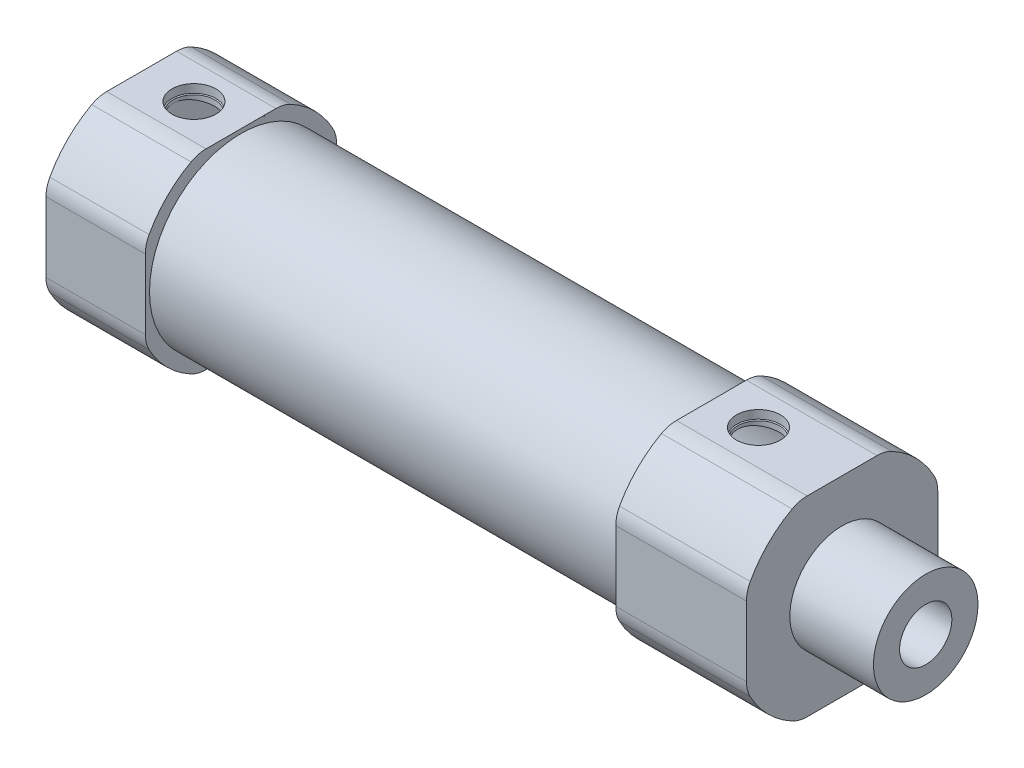
from build123d import *

# Parameters (mm, degrees)
SKETCH_473_R           = 8.75
EXTRUDE_523_DEPTH      = 67
EXTRUDE_START          = -12.5
SKETCH_1_R             = 8.75
EXTRUDE_925_DEPTH      = 12.5
SKETCH_1_2_R           = 8.75
EXTRUDE_1389_DEPTH     = 9.5
SKETCH_1_3_R           = 2
CUT_EXTRUDE_1656_DEPTH = 10
HOLE_WIZARD_1695_D     = 4.2
HOLE_WIZARD_1695_DEPTH = 0.8
HOLE_WIZARD_1695_TIP   = 1.2618073
CUT_EXTRUDE_START      = -3
SKETCH_1_4_R           = 8
CUT_EXTRUDE_3_DEPTH    = 61
SKETCH_1_5_R           = 5
EXTRUDE_2768_DEPTH     = 8
CUT_EXTRUDE_2998_REACH = 78.108
SKETCH_1_6_R           = 2.5
FILLET_2_R             = 3
FILLET_3_R             = 3


with BuildPart() as part:
    # Sketch 473 → Extrude 523 (new body)
    with BuildSketch(Plane(origin=(0, 0, 0), x_dir=(0, 0, -1), z_dir=(1, 0, 0))):
        Circle(SKETCH_473_R)
    extrude(amount=EXTRUDE_523_DEPTH)

    # Sketch 1 → Extrude 925 (add)
    with BuildSketch(Plane(origin=(67, 0, 0), x_dir=(0, 0, -1), z_dir=(1, 0, 0)).offset(EXTRUDE_START)):
        with BuildLine():
            Line((4.034538387, 9.15), (-4.034538387, 9.15))
            ThreePointArc((-4.034538387, 9.15), (-7.071067812, 7.071067812), (-9.15, 4.034538387))
            Line((-9.15, 4.034538387), (-9.15, -4.034538387))
            ThreePointArc((-9.15, -4.034538387), (-7.071067812, -7.071067812), (-4.034538387, -9.15))
            Line((-4.034538387, -9.15), (4.034538387, -9.15))
            ThreePointArc((4.034538387, -9.15), (7.071067812, -7.071067812), (9.15, -4.034538387))
            Line((9.15, -4.034538387), (9.15, 4.034538387))
            ThreePointArc((9.15, 4.034538387), (7.071067812, 7.071067812), (4.034538387, 9.15))
        make_face()
        Circle(SKETCH_1_R, mode=Mode.SUBTRACT)
    extrude(amount=EXTRUDE_925_DEPTH)

    # Sketch 1 2 → Extrude 1389 (add)
    with BuildSketch(Plane.ZY):
        with BuildLine():
            Line((4.034538387, 9.15), (-4.034538387, 9.15))
            ThreePointArc((-4.034538387, 9.15), (-7.071067812, 7.071067812), (-9.15, 4.034538387))
            Line((-9.15, 4.034538387), (-9.15, -4.034538387))
            ThreePointArc((-9.15, -4.034538387), (-7.071067812, -7.071067812), (-4.034538387, -9.15))
            Line((-4.034538387, -9.15), (4.034538387, -9.15))
            ThreePointArc((4.034538387, -9.15), (7.071067812, -7.071067812), (9.15, -4.034538387))
            Line((9.15, -4.034538387), (9.15, 4.034538387))
            ThreePointArc((9.15, 4.034538387), (7.071067812, 7.071067812), (4.034538387, 9.15))
        make_face()
        Circle(SKETCH_1_2_R, mode=Mode.SUBTRACT)
    extrude(amount=-EXTRUDE_1389_DEPTH)

    # Sketch 1 3 → Cut-Extrude 1656 (cut)
    with BuildSketch(Plane(origin=(0, 9.15, 0), x_dir=(1, 0, 0), z_dir=(0, 1, 0))):
        with Locations(Location((5, 0, 0), (0, 0, 270))):
            Circle(SKETCH_1_3_R)
        with Locations(Location((59, 0, 0), (0, 0, 270))):
            Circle(SKETCH_1_3_R)
    extrude(amount=-CUT_EXTRUDE_1656_DEPTH, mode=Mode.SUBTRACT)

    # Hole Wizard 1695
    with Locations(Plane(origin=(5, 9.15, 0), x_dir=(0, 0, 1), z_dir=(0, 1, 0))):
        with Locations((0, 0), (0, 54)):
            Hole(HOLE_WIZARD_1695_D / 2, depth=HOLE_WIZARD_1695_DEPTH)
            with Locations((0, 0, -(HOLE_WIZARD_1695_DEPTH + HOLE_WIZARD_1695_TIP / 2))):  # 118° drill point
                Cone(0, HOLE_WIZARD_1695_D / 2, HOLE_WIZARD_1695_TIP, mode=Mode.SUBTRACT)

    # Sketch 1 4 → 切除-拉伸3 (cut)
    with BuildSketch(Plane(origin=(67, 0, 0), x_dir=(0, 0, -1), z_dir=(1, 0, 0)).offset(CUT_EXTRUDE_START)):
        Circle(SKETCH_1_4_R)
    extrude(amount=-CUT_EXTRUDE_3_DEPTH, mode=Mode.SUBTRACT)

    # Sketch 1 5 → Extrude 2768 (add)
    with BuildSketch(Plane(origin=(67, 0, 0), x_dir=(0, 0, -1), z_dir=(1, 0, 0))):
        Circle(SKETCH_1_5_R)
    extrude(amount=EXTRUDE_2768_DEPTH)

    # Sketch 1 6 → Cut-Extrude 2998 (cut, up to next)
    with BuildSketch(Plane(origin=(75, 0, 0), x_dir=(0, 0, -1), z_dir=(1, 0, 0)), mode=Mode.PRIVATE) as cut_extrude_2998_sk1:
        Circle(SKETCH_1_6_R)
    cut_extrude_2998_tool1 = extrude(cut_extrude_2998_sk1.sketch, amount=-CUT_EXTRUDE_2998_REACH, mode=Mode.PRIVATE) & part.part
    add(cut_extrude_2998_tool1.solids().sort_by_distance((75, 0, 0))[0], mode=Mode.SUBTRACT)

    # 圆角2
    fillet_2_edges = [part.edges().sort_by_distance(p)[0] for p in [
        (4.75, 4.034538387, 9.15),
        (4.75, -4.034538387, 9.15),
        (4.75, -9.15, 4.034538387),
        (4.75, -9.15, -4.034538387),
        (4.75, -4.034538387, -9.15),
        (4.75, 4.034538387, -9.15),
        (4.75, 9.15, -4.034538387),
        (4.75, 9.15, 4.034538387),
    ]]
    fillet(fillet_2_edges, radius=FILLET_2_R)

    # 圆角3
    fillet_3_edges = [part.edges().sort_by_distance(p)[0] for p in [
        (60.75, 4.034538387, -9.15),
        (60.75, -4.034538387, -9.15),
        (60.75, -9.15, -4.034538387),
        (60.75, -9.15, 4.034538387),
        (60.75, -4.034538387, 9.15),
        (60.75, 4.034538387, 9.15),
        (60.75, 9.15, 4.034538387),
        (60.75, 9.15, -4.034538387),
    ]]
    fillet(fillet_3_edges, radius=FILLET_3_R)


solid = part.part
